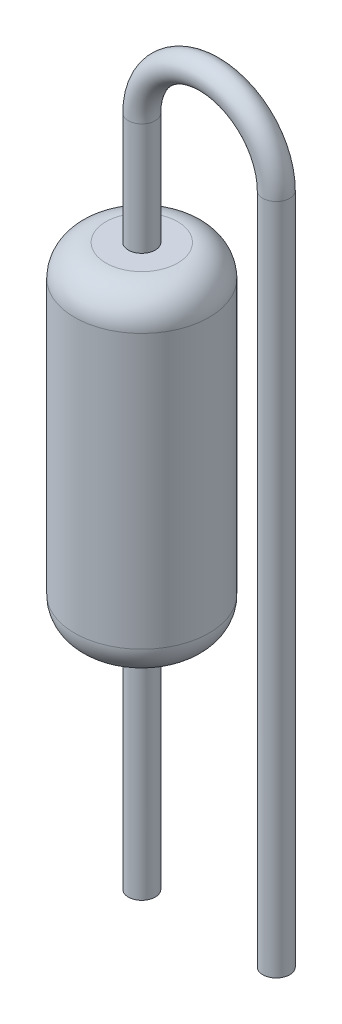
from build123d import *

# Parameters (mm, degrees)
SKETCH_2_R      = 0.3
SKETCH_3_R      = 1.5
EXTRUDE_1_DEPTH = 7.5
FILLET_1_R      = 0.7


with BuildPart() as part:
    # По траектории1: sweep along a path in Эскиз1
    with BuildLine(Plane.XY) as sweep_1_path:
        Line((0, 0), (0, 15))
        ThreePointArc((0, 15), (1.5, 16.5), (3, 15))
        Line((3, 15), (3, 0))
    # Эскиз2 → По траектории1 (sweep)
    with BuildSketch(Plane(origin=(0, 0, 0), x_dir=(1, 0, 0), z_dir=(0, 1, 0))):
        Circle(SKETCH_2_R)
    sweep(path=sweep_1_path.line)

    # Эскиз3 → Вытянуть1 (add)
    with BuildSketch(Plane.XZ.offset(-5)):
        with Locations(Location((0, 0, 0), (0, 0, 270))):
            Circle(SKETCH_3_R)
    extrude(amount=-EXTRUDE_1_DEPTH)

    # Скругление1
    fillet_1_edges = [part.edges().sort_by_distance(p)[0] for p in [
        (0, 5, 1.5),
        (0, 12.5, 1.5),
    ]]
    fillet(fillet_1_edges, radius=FILLET_1_R)


solid = part.part
